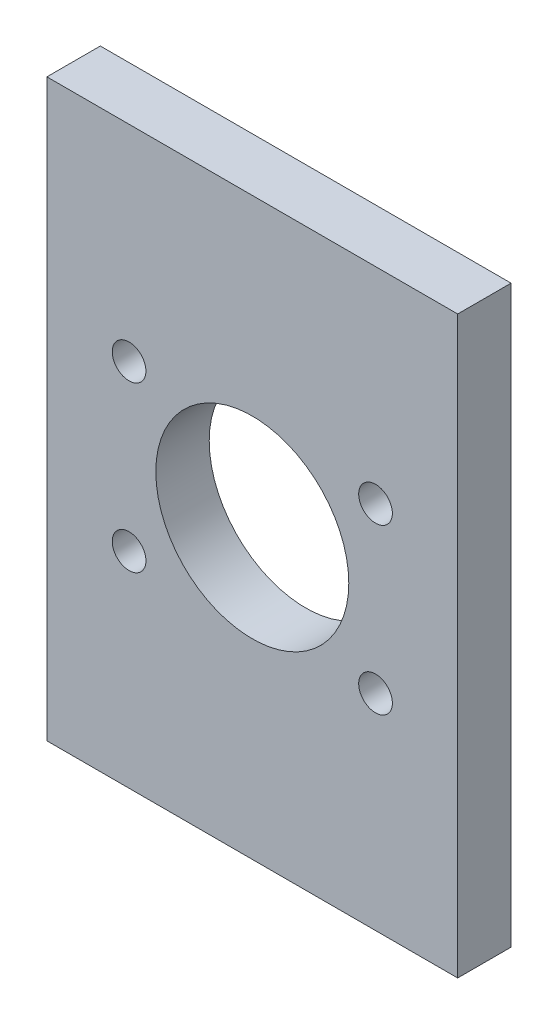
from build123d import *

# Parameters (mm, degrees)
SKETCH1_W                = 100
SKETCH1_H                = 140
SKETCH1_R                = 23.49
BOSS_EXTRUDE1_DEPTH      = 13
M8_CLEARANCE_HOLE1_D     = 8.2
M8_CLEARANCE_HOLE1_DEPTH = 19.75
M8_CLEARANCE_HOLE1_TIP   = 2.463528538


with BuildPart() as part:
    # Sketch1 → Boss-Extrude1 (new body)
    with BuildSketch(Plane.XY):
        Rectangle(SKETCH1_W, SKETCH1_H)
        with Locations(Location((0, 0, 0), (0, 0, 180))):
            Circle(SKETCH1_R, mode=Mode.SUBTRACT)
    extrude(amount=BOSS_EXTRUDE1_DEPTH)

    # M8 Clearance Hole1
    with Locations(Plane(origin=(-30, 20, 13), x_dir=(1, 0, 0), z_dir=(0, 0, 1))):
        with Locations((0, 0), (60, 0), (60, -40), (0, -40)):
            Hole(M8_CLEARANCE_HOLE1_D / 2, depth=M8_CLEARANCE_HOLE1_DEPTH)
            with Locations((0, 0, -(M8_CLEARANCE_HOLE1_DEPTH + M8_CLEARANCE_HOLE1_TIP / 2))):  # 118° drill point
                Cone(0, M8_CLEARANCE_HOLE1_D / 2, M8_CLEARANCE_HOLE1_TIP, mode=Mode.SUBTRACT)


solid = part.part
